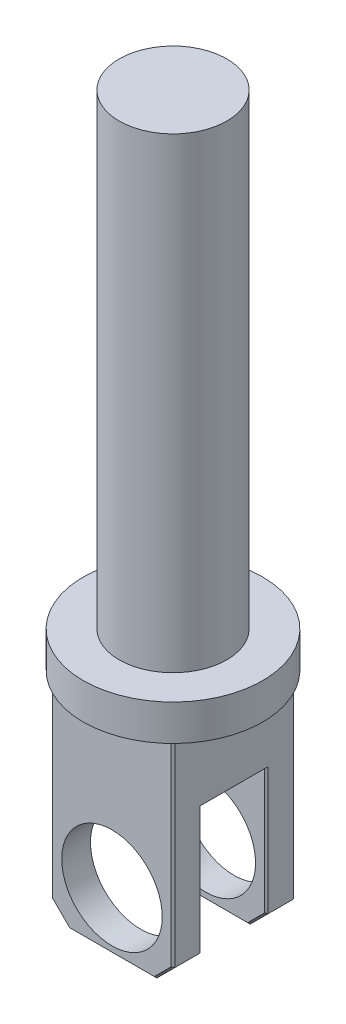
from build123d import *

# Parameters (mm, degrees)
SKETCH1_R                           = 12.5
BOSS_EXTRUDE1_DEPTH                 = 50
CUT_EXTRUDE1_REACH                  = 55.033
CUT_EXTRUDE1_END_RADIUS             = 12.5
SKETCH2_R                           = 7
CUT_EXTRUDE1_DIRECTION_2_REACH      = 55.033
CUT_EXTRUDE1_DIRECTION_2_END_RADIUS = 12.5
CUT_EXTRUDE2_REACH                  = 55.033
SKETCH3_W                           = 9
SKETCH3_H                           = 20
CUT_EXTRUDE2_DIRECTION_2_REACH      = 55.033
SKETCH4_OUTSIDE_W                   = 48.214
SKETCH4_OUTSIDE_H                   = 48.214
SKETCH4_OUTSIDE_W_2                 = 17
SKETCH4_OUTSIDE_H_2                 = 17
CUT_EXTRUDE4_DEPTH                  = 30
SKETCH5_R                           = 12.5
SKETCH5_R_2                         = 7.5
CUT_EXTRUDE5_DEPTH                  = 70
CHAMFER2_SIZE                       = 2.5
CHAMFER1_SIZE                       = 0.25
SKETCH7_R                           = 12.5
BOSS_EXTRUDE2_DEPTH                 = 5


with BuildPart() as part:
    # Sketch1 → Boss-Extrude1 (new, symmetric)
    with BuildSketch(Plane(origin=(0, 0, 0), x_dir=(1, 0, 0), z_dir=(0, 1, 0))):
        with Locations(Location((0, 0, 0), (0, 0, 270))):
            Circle(SKETCH1_R)
    extrude(amount=BOSS_EXTRUDE1_DEPTH, both=True)

    # Cut-Extrude1: up to this cylinder (the profile starts inside it)
    cut_extrude1_end = Plane(origin=(0, -42, 0), z_dir=(0, -1, 0)) * Cylinder(CUT_EXTRUDE1_END_RADIUS, 136.066, mode=Mode.PRIVATE)
    # Sketch2 → Cut-Extrude1 (cut, up to the surface)
    with BuildSketch(Plane.XY, mode=Mode.PRIVATE) as cut_extrude1_sk1:
        with Locations(Location((0, -42, 0), (0, 0, 180))):
            Circle(SKETCH2_R)
    cut_extrude1_tool1 = extrude(cut_extrude1_sk1.sketch, amount=-CUT_EXTRUDE1_REACH, mode=Mode.PRIVATE) & cut_extrude1_end
    add(cut_extrude1_tool1.solids().sort_by_distance((0, -42, 0))[0], mode=Mode.SUBTRACT)

    # Cut-Extrude1 direction 2: up to this cylinder (the profile starts inside it)
    cut_extrude1_direction_2_end = Plane(origin=(0, -42, 0), z_dir=(0, -1, 0)) * Cylinder(CUT_EXTRUDE1_DIRECTION_2_END_RADIUS, 136.066, mode=Mode.PRIVATE)
    # Sketch2 → Cut-Extrude1 direction 2 (cut, up to the surface)
    with BuildSketch(Plane.XY, mode=Mode.PRIVATE) as cut_extrude1_direction_2_sk1:
        with Locations(Location((0, -42, 0), (0, 0, 180))):
            Circle(SKETCH2_R)
    cut_extrude1_direction_2_tool1 = extrude(cut_extrude1_direction_2_sk1.sketch, amount=CUT_EXTRUDE1_DIRECTION_2_REACH, mode=Mode.PRIVATE) & cut_extrude1_direction_2_end
    add(cut_extrude1_direction_2_tool1.solids().sort_by_distance((0, -42, 0))[0], mode=Mode.SUBTRACT)

    # Sketch3 → Cut-Extrude2 (cut, up to next)
    with BuildSketch(Plane(origin=(0, 0, 0), x_dir=(0, 0, -1), z_dir=(1, 0, 0)), mode=Mode.PRIVATE) as cut_extrude2_sk1:
        with Locations((0, -40)):
            Rectangle(SKETCH3_W, SKETCH3_H)
    cut_extrude2_tool1 = extrude(cut_extrude2_sk1.sketch, amount=-CUT_EXTRUDE2_REACH, mode=Mode.PRIVATE) & part.part
    add(cut_extrude2_tool1.solids().sort_by_distance((0, -40, 0))[0], mode=Mode.SUBTRACT)

    # Sketch3 → Cut-Extrude2 direction 2 (cut, up to next)
    with BuildSketch(Plane(origin=(0, 0, 0), x_dir=(0, 0, -1), z_dir=(1, 0, 0)), mode=Mode.PRIVATE) as cut_extrude2_direction_2_sk1:
        with Locations((0, -40)):
            Rectangle(SKETCH3_W, SKETCH3_H)
    cut_extrude2_direction_2_tool1 = extrude(cut_extrude2_direction_2_sk1.sketch, amount=CUT_EXTRUDE2_DIRECTION_2_REACH, mode=Mode.PRIVATE) & part.part
    add(cut_extrude2_direction_2_tool1.solids().sort_by_distance((0, -40, 0))[0], mode=Mode.SUBTRACT)

    # Sketch4 outside → Cut-Extrude4 (cut)
    with BuildSketch(Plane.XZ.offset(50)):
        Rectangle(SKETCH4_OUTSIDE_W, SKETCH4_OUTSIDE_H)
        Rectangle(SKETCH4_OUTSIDE_W_2, SKETCH4_OUTSIDE_H_2, mode=Mode.SUBTRACT)
    extrude(amount=-CUT_EXTRUDE4_DEPTH, mode=Mode.SUBTRACT)

    # Sketch5 → Cut-Extrude5 (cut)
    with BuildSketch(Plane(origin=(0, 50, 0), x_dir=(1, 0, 0), z_dir=(0, 1, 0))):
        Circle(SKETCH5_R)
        with Locations(Location((0, 0, 0), (0, 0, 270))):
            Circle(SKETCH5_R_2, mode=Mode.SUBTRACT)
    extrude(amount=-CUT_EXTRUDE5_DEPTH, mode=Mode.SUBTRACT)

    # Chamfer2
    chamfer2_edges = [part.edges().sort_by_distance(p)[0] for p in [
        (8.5, -50, 6.5),
        (8.5, -50, -6.5),
        (-8.5, -50, 6.5),
        (-8.5, -50, -6.5),
    ]]
    chamfer(chamfer2_edges, length=CHAMFER2_SIZE)

    # Chamfer1
    chamfer1_edges = [part.edges().sort_by_distance(p)[0] for p in [
        (-8.5, -30, 0),
        (8.5, -30, 0),
        (0, -20, -8.5),
        (8.5, -20, 0),
        (0, -20, 8.5),
        (-8.5, -20, 0),
        (8.5, -38.75, 4.5),
        (8.5, -33.75, -8.5),
        (-8.5, -33.75, -8.5),
        (-8.5, -38.75, -4.5),
        (-8.5, -33.75, 8.5),
        (8.5, -33.75, 8.5),
        (0, -50, -4.5),
        (0, -50, -8.5),
        (8.5, -38.75, -4.5),
        (-7.25, -48.75, -4.5),
        (7.25, -48.75, -4.5),
        (-7.25, -48.75, -8.5),
        (7.25, -48.75, -8.5),
        (0, -50, 8.5),
        (0, -50, 4.5),
        (-7.25, -48.75, 8.5),
        (7.25, -48.75, 8.5),
        (-8.5, -38.75, 4.5),
        (-7.25, -48.75, 4.5),
        (7.25, -48.75, 4.5),
    ]]
    chamfer(chamfer1_edges, length=CHAMFER1_SIZE)

    # Sketch7 → Boss-Extrude2 (add)
    with BuildSketch(Plane(origin=(0, -20, 0), x_dir=(1, 0, 0), z_dir=(0, 1, 0))):
        with Locations(Location((0, 0, 0), (0, 0, 270))):
            Circle(SKETCH7_R)
    extrude(amount=BOSS_EXTRUDE2_DEPTH)


solid = part.part
